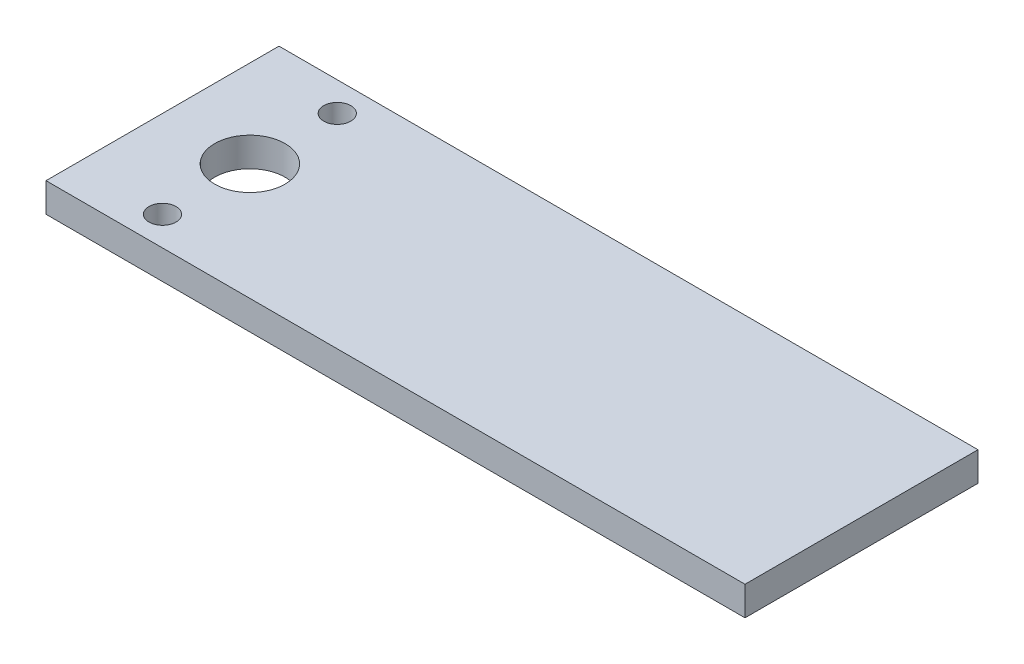
from build123d import *

# Parameters (mm, degrees)
SKETCH1_W           = 76.2
SKETCH1_H           = 25.4
SKETCH1_R           = 1.4732
SKETCH1_R_2         = 3.8354
BOSS_EXTRUDE1_DEPTH = 3.175


with BuildPart() as part:
    # Sketch1 → Boss-Extrude1 (new body)
    with BuildSketch(Plane(origin=(0, 0, 0), x_dir=(1, 0, 0), z_dir=(0, 1, 0))):
        with Locations((38.1, 12.7)):
            Rectangle(SKETCH1_W, SKETCH1_H)
        with Locations(Location((9.525, 22.225, 0), (0, 0, 270))):
            Circle(SKETCH1_R, mode=Mode.SUBTRACT)
        with Locations(Location((9.525, 3.175, 0), (0, 0, 270))):
            Circle(SKETCH1_R, mode=Mode.SUBTRACT)
        with Locations(Location((9.525, 12.7, 0), (0, 0, 270))):
            Circle(SKETCH1_R_2, mode=Mode.SUBTRACT)
    extrude(amount=BOSS_EXTRUDE1_DEPTH)


solid = part.part
